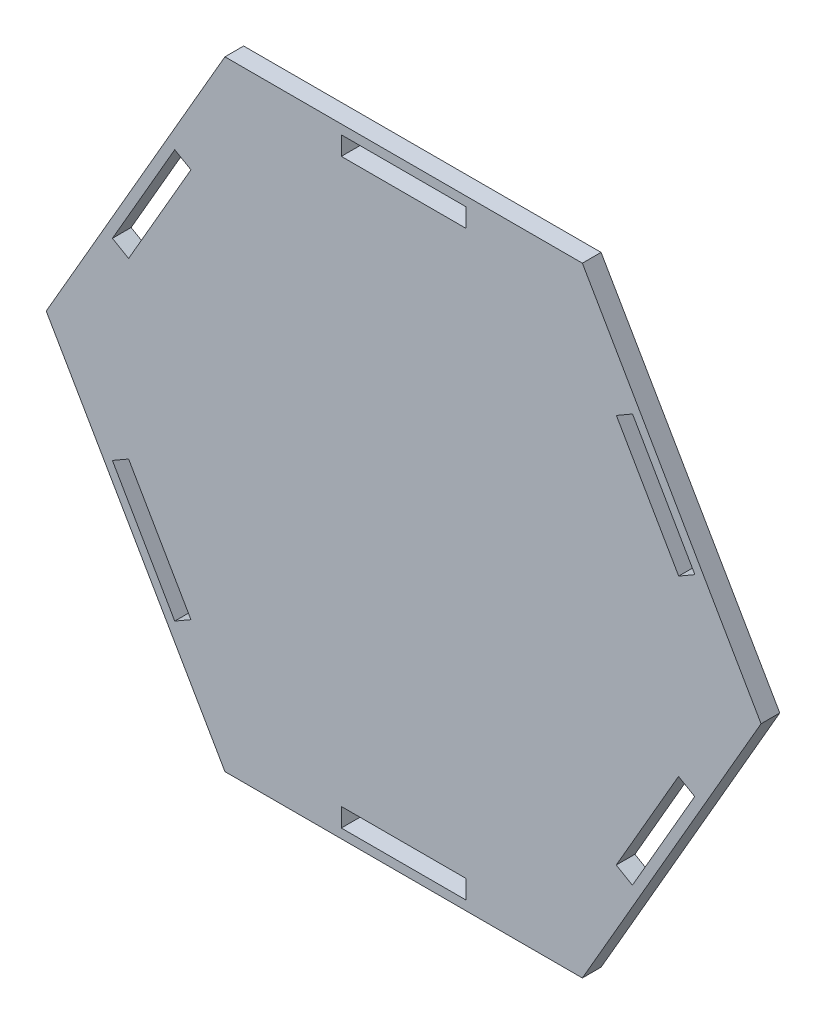
from build123d import *

# Parameters (mm, degrees)
MODEL_W             = 20
MODEL_H             = 3
BOSS_EXTRUDE1_DEPTH = 3


with BuildPart() as part:
    # Model → Boss-Extrude1 (new body)
    with BuildSketch(Plane.XY):
        Polygon((149.457182746, 55.697979038), (120.785258916, 105.359207863), (63.441411255, 105.359207863), (34.769487424, 55.697979038), (63.441411255, 6.036750213), (120.785258916, 6.036750213), align=None)
        with Locations((92.113335085, 102.359207863)):
            Rectangle(MODEL_W, MODEL_H, mode=Mode.SUBTRACT)
        with Locations((92.113335085, 9.036750213)):
            Rectangle(MODEL_W, MODEL_H, mode=Mode.SUBTRACT)
        Polygon((126.215627262, 24.442424093), (128.813703474, 22.942424093), (138.813703474, 40.262932169), (136.215627262, 41.762932169), align=None, mode=Mode.SUBTRACT)
        Polygon((128.839141228, 88.429056492), (126.241065016, 86.929056492), (136.241065016, 69.608548416), (138.839141228, 71.108548416), align=None, mode=Mode.SUBTRACT)
        Polygon((55.387528943, 22.927737599), (57.985605154, 24.427737599), (47.985605154, 41.748245675), (45.387528943, 40.248245675), align=None, mode=Mode.SUBTRACT)
        Polygon((45.387528943, 71.108548416), (47.985605154, 69.608548416), (57.985605154, 86.929056492), (55.387528943, 88.429056492), align=None, mode=Mode.SUBTRACT)
    extrude(amount=BOSS_EXTRUDE1_DEPTH)


solid = part.part
